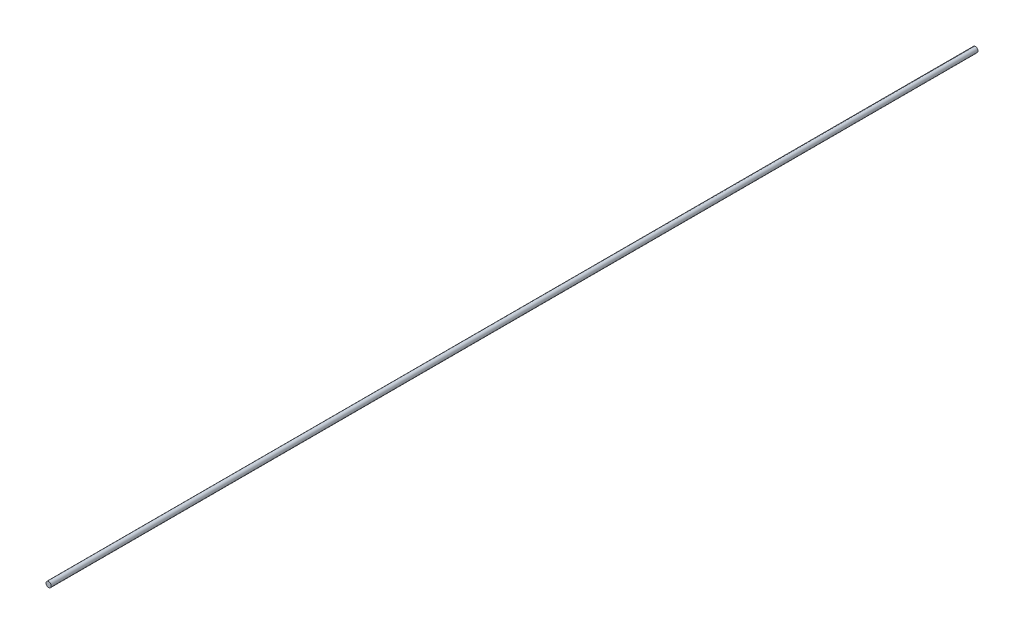
from build123d import *

# Parameters (mm, degrees)
SKETCH1_R           = 12.7
BOSS_EXTRUDE1_DEPTH = 4491.963552734


with BuildPart() as part:
    # Sketch1 → Boss-Extrude1 (new body)
    with BuildSketch(Plane.XY):
        Circle(SKETCH1_R)
    extrude(amount=BOSS_EXTRUDE1_DEPTH)


solid = part.part
